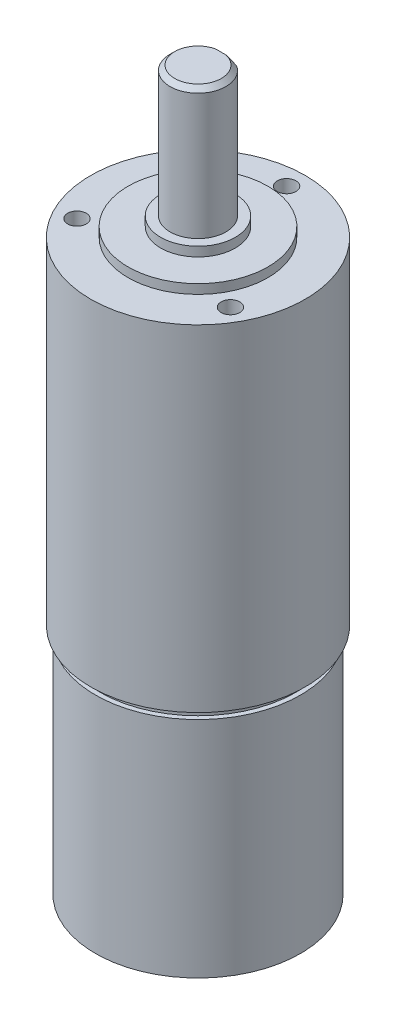
from build123d import *

# Parameters (mm, degrees)
ENL_V_MAT_EXTRU_2_DEPTH = 10
CHANFREIN1_SIZE         = 0.5
ESQUISSE3_R             = 1
ENL_V_MAT_EXTRU_3_DEPTH = 4


with BuildPart() as part:
    # Esquisse1 → Révolution1 (revolve)
    with BuildSketch(Plane.XY, mode=Mode.PRIVATE) as r_volution1_sk:
        Polygon((0, 0), (7.5, 0), (7.5, 2), (11, 2), (11, 26), (10.5, 26), (10.5, 27), (11.5, 27), (11.5, 63), (7.5, 63), (7.5, 64), (4, 64), (4, 65), (3, 65), (3, 79), (0, 79), align=None)
    revolve(r_volution1_sk.sketch.rotate(Axis((0, 0, 0), (0, 1, 0)), 90), axis=Axis((0, 0, 0), (0, 1, 0)))

    # Esquisse2 → Enlèv. mat.-Extru.2 (cut)
    with BuildSketch(Plane(origin=(0, 79, 0), x_dir=(1, 0, 0), z_dir=(0, 1, 0))):
        with BuildLine():
            Line((-1.75, 2.436698586), (1.75, 2.436698586))
            ThreePointArc((1.75, 2.436698586), (0, 3), (-1.75, 2.436698586))
        make_face()
    extrude(amount=-ENL_V_MAT_EXTRU_2_DEPTH, mode=Mode.SUBTRACT)

    # Chanfrein1
    chanfrein1_edges = [part.edges().sort_by_distance(p)[0] for p in [
        (0, 79, 3),
    ]]
    chamfer(chanfrein1_edges, length=CHANFREIN1_SIZE)

    # Esquisse3 → Enlèv. mat.-Extru.3 (cut)
    with BuildSketch(Plane(origin=(0, 63, 0), x_dir=(1, 0, 0), z_dir=(0, 1, 0))):
        with Locations(Location((0, 9.5, 0), (0, 0, 270))):
            Circle(ESQUISSE3_R)
        with Locations(Location((8.227241336, -4.75, 0), (0, 0, 270))):
            Circle(ESQUISSE3_R)
        with Locations(Location((-8.227241336, -4.75, 0), (0, 0, 270))):
            Circle(ESQUISSE3_R)
    extrude(amount=-ENL_V_MAT_EXTRU_3_DEPTH, mode=Mode.SUBTRACT)


solid = part.part
